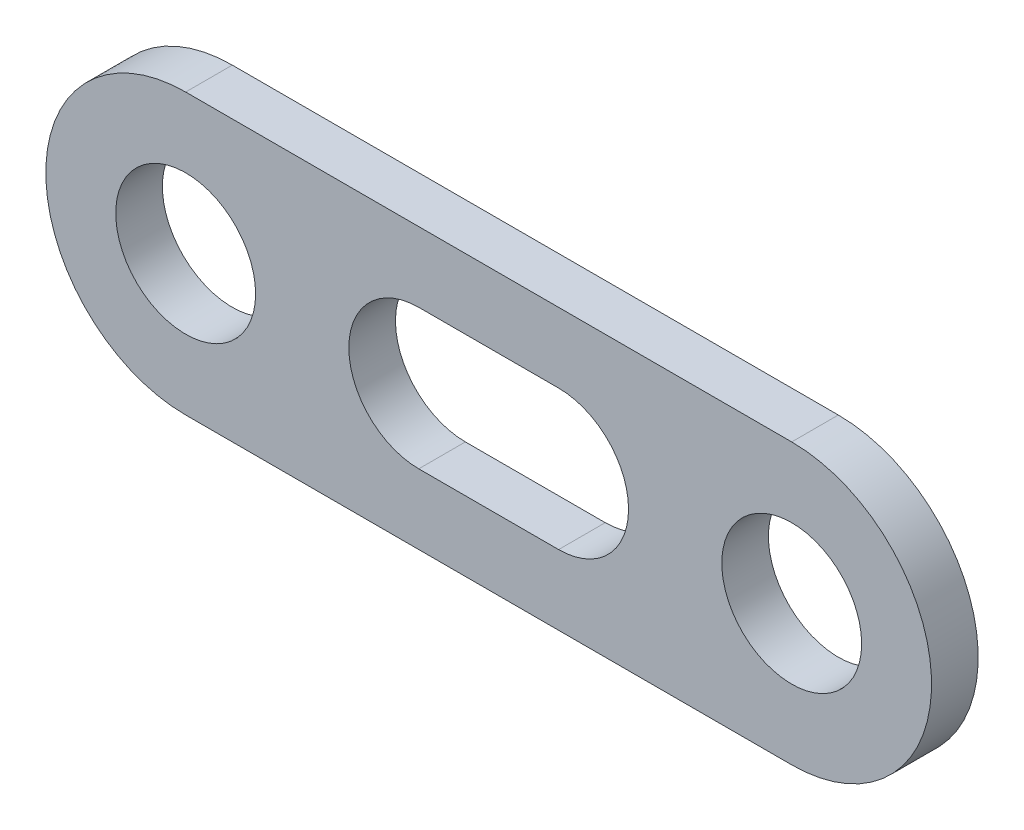
from build123d import *

# Parameters (mm, degrees)
SKETCH_2_R      = 3
EXTRUDE_1_DEPTH = 2


with BuildPart() as part:
    # 草图2 → 凸台-拉伸1 (new body)
    with BuildSketch(Plane.XY):
        with BuildLine():
            Line((0, 6), (26, 6))
            ThreePointArc((26, 6), (32, 0), (26, -6))
            Line((26, -6), (0, -6))
            ThreePointArc((0, -6), (-6, 0), (0, 6))
        make_face()
        Circle(SKETCH_2_R, mode=Mode.SUBTRACT)
        with Locations((26, 0)):
            Circle(SKETCH_2_R, mode=Mode.SUBTRACT)
        with BuildLine():
            Line((10, 3), (16, 3))
            ThreePointArc((16, 3), (19, 0), (16, -3))
            Line((16, -3), (10, -3))
            ThreePointArc((10, -3), (7, 0), (10, 3))
        make_face(mode=Mode.SUBTRACT)
    extrude(amount=EXTRUDE_1_DEPTH)


solid = part.part
